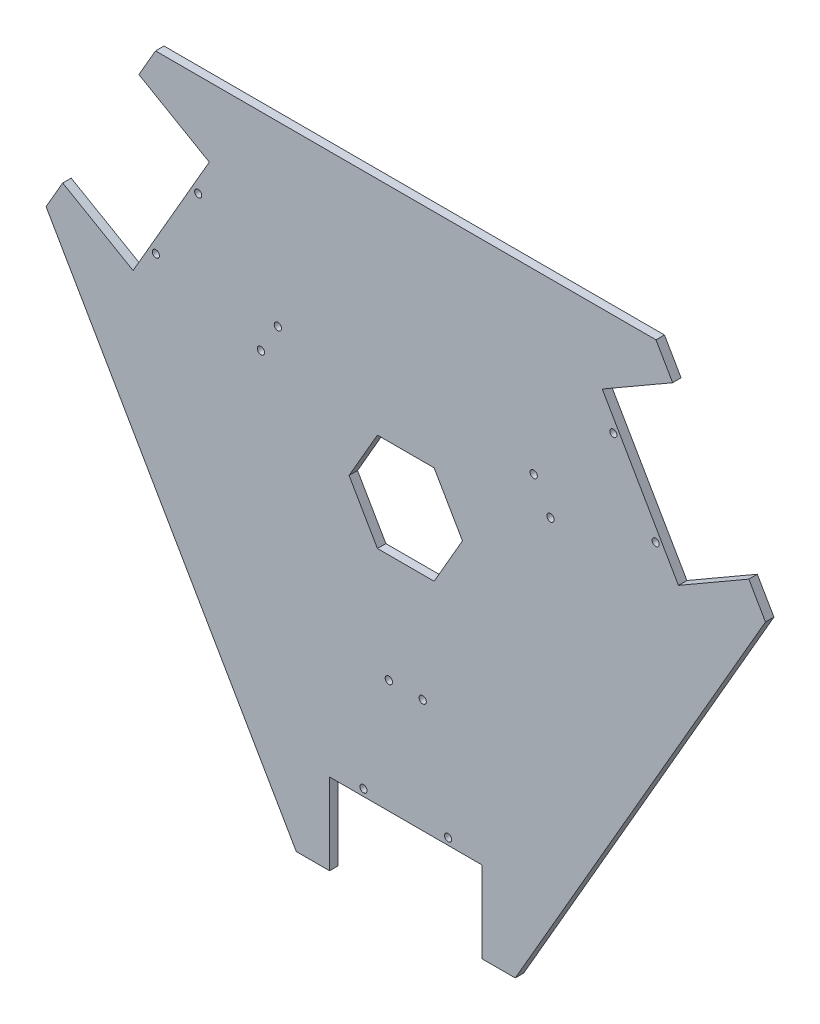
from build123d import *

# Parameters (mm, degrees)
EXTRUDE_1_DEPTH          = 5
CUT_EXTRUDE_1_DEPTH      = 424.349737215
M5X0_8_1_D               = 4.2
HOLE_WIZARD_M4_1_D       = 4.3
PATTERN_CIRCULAR_1_COUNT = 3
CUT_EXTRUDE_2_DEPTH      = 298.372381591


with BuildPart() as part:
    # 草圖1 → 填料-伸長1 (new body)
    with BuildSketch(Plane.XY):
        Polygon((0, -320), (277.128129211, 160), (-277.128129211, 160), align=None)
    extrude(amount=EXTRUDE_1_DEPTH)

    # 草圖6 → 除料-伸長1 (cut, through all)
    with BuildSketch(Plane.XY.offset(5)):
        Polygon((-64.663230149, -208), (-45, -208), (-45, -160), (45, -160), (45, -208), (64.663230149, -208), (0, -320), align=None)
    cut_extrude_1 = extrude(amount=-CUT_EXTRUDE_1_DEPTH, mode=Mode.SUBTRACT)

    # M5x0.8 螺紋孔1 (through all)
    with Locations(Plane.XY.offset(5)):
        with Locations((25, -156), (-25, -156)):
            m5x0_8_1 = Hole(M5X0_8_1_D / 2)

    # M4 餘隙孔1 (through all)
    with Locations(Plane.XY.offset(5)):
        with Locations((10, -93), (-10, -93)):
            hole_wizard_m4_1 = Hole(HOLE_WIZARD_M4_1_D / 2)

    # 環狀複製排列1: 除料-伸長1, M5x0.8 螺紋孔1, M4 餘隙孔1 ×3 about axis
    pattern_circular_1_axis = Axis((0, 0, -0.25), (0, 0, 1))
    add([cut_extrude_1.rotate(pattern_circular_1_axis, i * 360 / PATTERN_CIRCULAR_1_COUNT) for i in range(1, PATTERN_CIRCULAR_1_COUNT)], mode=Mode.SUBTRACT)
    add([m5x0_8_1.rotate(pattern_circular_1_axis, i * 360 / PATTERN_CIRCULAR_1_COUNT) for i in range(1, PATTERN_CIRCULAR_1_COUNT)], mode=Mode.SUBTRACT)
    add([hole_wizard_m4_1.rotate(pattern_circular_1_axis, i * 360 / PATTERN_CIRCULAR_1_COUNT) for i in range(1, PATTERN_CIRCULAR_1_COUNT)], mode=Mode.SUBTRACT)

    # 草圖11 → 除料-伸長2 (cut, through all)
    with BuildSketch(Plane.XY.offset(5)):
        Polygon((33.486315613, 0), (16.743157806, 29), (-16.743157806, 29), (-33.486315613, 0), (-16.743157806, -29), (16.743157806, -29), align=None)
    extrude(amount=-CUT_EXTRUDE_2_DEPTH, mode=Mode.SUBTRACT)


solid = part.part
